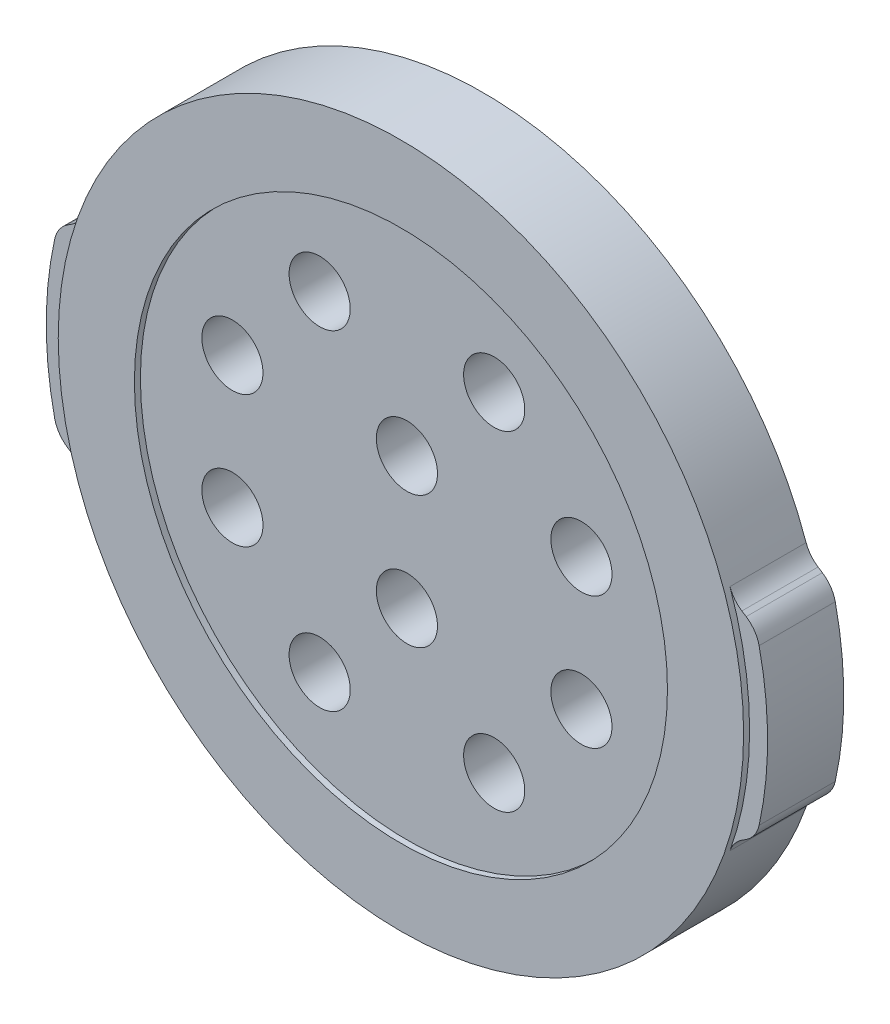
from build123d import *

# Parameters (mm, degrees)
SKETCH1_R              = 1.6
BOSS_EXTRUDE1_DEPTH    = 12.7
SKETCH6_R              = 5.1
CUT_EXTRUDE2_DEPTH     = 84.93709
FILLET1_R              = 5
SKETCH7_R              = 57.15
SKETCH7_R_2            = 44.45
ANALYSIS_SUPPORT_DEPTH = 1


with BuildPart() as part:
    # Sketch1 → Boss-Extrude1 (new body)
    with BuildSketch(Plane.XY):
        with BuildLine():
            Line((54.40471, 17.5), (58.249657, 15))
            ThreePointArc((58.249657, 15), (60.15, 0), (58.249657, -15))
            Line((58.249657, -15), (54.40471, -17.5))
            ThreePointArc((54.40471, -17.5), (0, -57.15), (-54.40471, -17.5))
            Line((-54.40471, -17.5), (-58.249657, -15))
            ThreePointArc((-58.249657, -15), (-60.15, 0), (-58.249657, 15))
            Line((-58.249657, 15), (-54.40471, 17.5))
            ThreePointArc((-54.40471, 17.5), (0, 57.15), (54.40471, 17.5))
        make_face()
        with Locations((0, 53.975)):
            Circle(SKETCH1_R, mode=Mode.SUBTRACT)
        with Locations((46.743721, 26.9875)):
            Circle(SKETCH1_R, mode=Mode.SUBTRACT)
        with Locations((46.743721, -26.9875)):
            Circle(SKETCH1_R, mode=Mode.SUBTRACT)
        with Locations((0, -53.975)):
            Circle(SKETCH1_R, mode=Mode.SUBTRACT)
        with Locations((-46.743721, -26.9875)):
            Circle(SKETCH1_R, mode=Mode.SUBTRACT)
        with Locations((-46.743721, 26.9875)):
            Circle(SKETCH1_R, mode=Mode.SUBTRACT)
    extrude(amount=BOSS_EXTRUDE1_DEPTH)

    # Sketch6 → Cut-Extrude2 (cut, through all)
    with BuildSketch(Plane(origin=(0, 0, 0), x_dir=(-1, 0, 0), z_dir=(0, 0, -1))):
        with Locations((14.551632, 27.5)):
            Circle(SKETCH6_R)
        with Locations((-29.103264, 11)):
            Circle(SKETCH6_R)
        with Locations((-29.103264, -11)):
            Circle(SKETCH6_R)
        with Locations((29.103264, -11)):
            Circle(SKETCH6_R)
        with Locations((29.103264, 11)):
            Circle(SKETCH6_R)
        with Locations((-14.551632, 27.5)):
            Circle(SKETCH6_R)
        with Locations((0, -11)):
            Circle(SKETCH6_R)
        with Locations((-14.551632, -27.5)):
            Circle(SKETCH6_R)
        with Locations((0, 11)):
            Circle(SKETCH6_R)
        with Locations((14.551632, -27.5)):
            Circle(SKETCH6_R)
    extrude(amount=-CUT_EXTRUDE2_DEPTH, mode=Mode.SUBTRACT)

    # Fillet1
    fillet1_edges = [part.edges().sort_by_distance(p)[0] for p in [
        (54.40471, 17.5, 6.35),
        (58.249657, 15, 6.35),
        (58.249657, -15, 6.35),
        (54.40471, -17.5, 6.35),
        (-54.40471, -17.5, 6.35),
        (-58.249657, -15, 6.35),
        (-58.249657, 15, 6.35),
        (-54.40471, 17.5, 6.35),
    ]]
    fillet(fillet1_edges, radius=FILLET1_R)

    # Sketch7 → ANALYSIS-SUPPORT (add)
    with BuildSketch(Plane.XY.offset(12.7)):
        with Locations(Location((0, 0, 0), (0, 0, 160.500332))):
            Circle(SKETCH7_R)
        Circle(SKETCH7_R_2, mode=Mode.SUBTRACT)
    extrude(amount=ANALYSIS_SUPPORT_DEPTH)


solid = part.part
